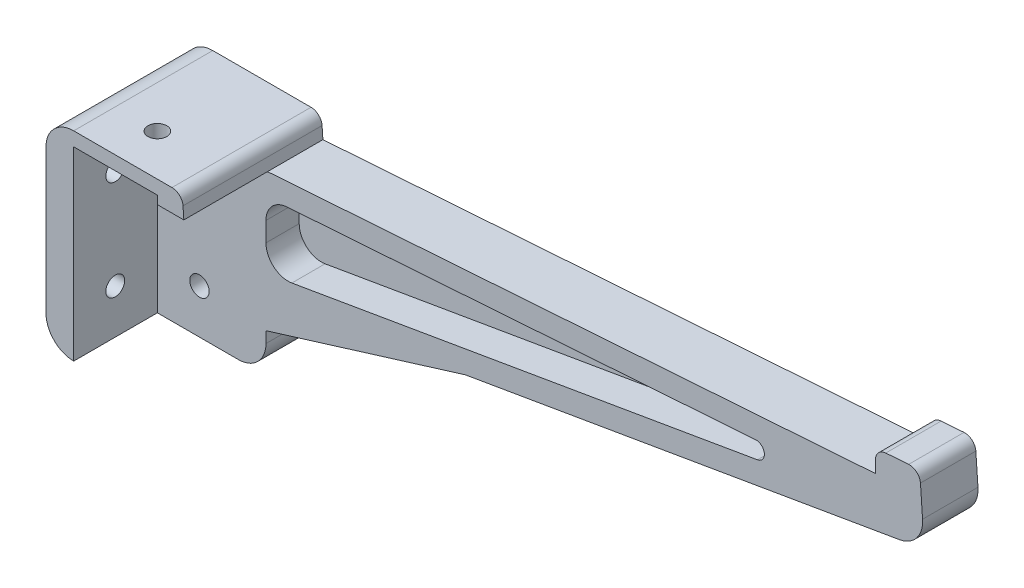
from build123d import *

# Parameters (mm, degrees)
SKETCH1_R            = 1.75
BOSS_EXTRUDE1_DEPTH  = 10
CUT_EXTRUDE1_DEPTH   = 6
BOSS_EXTRUDE2_DEPTH  = 10
BOSS_EXTRUDE3_DEPTH  = 15.1
M3_CLEARANCE_HOLE1_D = 3.4
M3_CLEARANCE_HOLE2_D = 3.4


with BuildPart() as part:
    # Sketch1 → Boss-Extrude1 (new body)
    with BuildSketch(Plane.XY):
        with BuildLine():
            Line((-7.6, 10), (10.134969828, 10))
            ThreePointArc((10.134969828, 10), (11.498966548, 9.462707403), (12.130097928, 8.139512947))
            Line((12.130097928, 8.139512947), (12.279025895, 6.009743799))
            Line((12.279025895, 6.009743799), (122.011071424, 13.682955911))
            Line((122.011071424, 13.682955911), (122.011071424, 15.827693331))
            ThreePointArc((122.011071424, 15.827693331), (122.54836402, 17.191690051), (123.871558476, 17.822821431))
            Line((123.871558476, 17.822821431), (127.996455725, 18.111262346))
            ThreePointArc((127.996455725, 18.111262346), (129.448086731, 17.625553406), (130.131096773, 16.255647193))
            Line((130.131096773, 16.255647193), (130.513028814, 10.79376454))
            ThreePointArc((130.513028814, 10.79376454), (129.45752894, 7.356802052), (126.3687377, 5.516649939))
            Line((126.3687377, 5.516649939), (12, -14.058605554))
            Line((12, -14.058605554), (12, -21))
            ThreePointArc((12, -21), (10.535533906, -24.535533906), (7, -26))
            Line((7, -26), (-7.6, -26))
            ThreePointArc((-7.6, -26), (-11.135533906, -24.535533906), (-12.6, -21))
            Line((-12.6, -21), (-12.6, 5))
            ThreePointArc((-12.6, 5), (-11.135533906, 8.535533906), (-7.6, 10))
        make_face()
        Circle(SKETCH1_R, mode=Mode.SUBTRACT)
        with Locations((0, -18)):
            Circle(SKETCH1_R, mode=Mode.SUBTRACT)
    extrude(amount=BOSS_EXTRUDE1_DEPTH)

    # Sketch2 → Cut-Extrude1 (cut)
    with BuildSketch(Plane.XY.offset(10)):
        with BuildLine():
            Line((12, -5.257633034), (12, -1.749595529))
            ThreePointArc((12, -1.749595529), (13.074585194, 0.978397911), (15.720974105, 2.240660672))
            Line((15.720974105, 2.240660672), (100.359457674, 8.159159996))
            ThreePointArc((100.359457674, 8.159159996), (101.953365437, 6.84188311), (100.717151126, 5.18431425))
            Line((100.717151126, 5.18431425), (16.67482331, -9.20029882))
            ThreePointArc((16.67482331, -9.20029882), (13.421172092, -8.31535222), (12, -5.257633034))
        make_face()
    extrude(amount=-CUT_EXTRUDE1_DEPTH, mode=Mode.SUBTRACT)

    # Sketch4 → Boss-Extrude2 (add)
    with BuildSketch(Plane.XY.offset(10)):
        Polygon((12, -18.990256201), (48, -7.896876292), (12, -14.058605554), align=None)
    extrude(amount=-BOSS_EXTRUDE2_DEPTH)

    # Sketch5 → Boss-Extrude3 (add)
    with BuildSketch(Plane.XY.offset(10)):
        with BuildLine():
            Line((-7.6, 7.5), (-7.6, -26))
            ThreePointArc((-7.6, -26), (-11.135533906, -24.535533906), (-12.6, -21))
            Line((-12.6, -21), (-12.6, 5))
            ThreePointArc((-12.6, 5), (-11.135533906, 8.535533906), (-7.6, 10))
            Line((-7.6, 10), (10.134969828, 10))
            ThreePointArc((10.134969828, 10), (11.498966548, 9.462707403), (12.130097928, 8.139512947))
            Line((12.130097928, 8.139512947), (12.279025895, 6.009743799))
            Line((12.279025895, 6.009743799), (7.5, 6.009743799))
            Line((7.5, 6.009743799), (7.5, 7.5))
            Line((7.5, 7.5), (-7.6, 7.5))
        make_face()
    extrude(amount=BOSS_EXTRUDE3_DEPTH)

    # M3 Clearance Hole1 (through all)
    with Locations(Plane(origin=(-7.6, 0, 0), x_dir=(0, 0, -1), z_dir=(1, 0, 0))):
        with Locations((-17.6, -18), (-17.6, 0)):
            Hole(M3_CLEARANCE_HOLE1_D / 2)

    # M3 Clearance Hole2 (through all)
    with Locations(Plane(origin=(0, 10, 0), x_dir=(1, 0, 0), z_dir=(0, 1, 0))):
        with Locations((0, -17.6)):
            Hole(M3_CLEARANCE_HOLE2_D / 2)


solid = part.part
